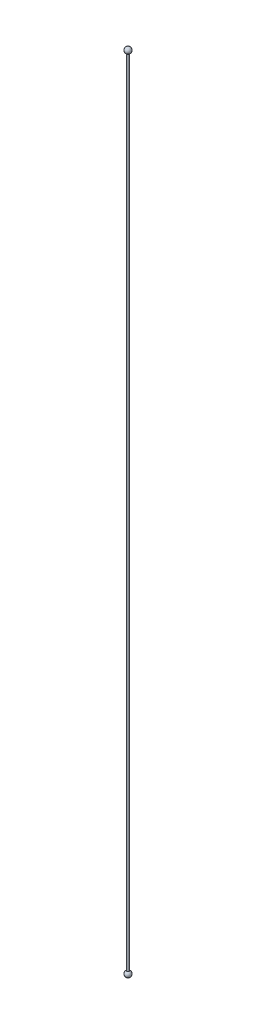
from build123d import *


with BuildPart() as part:
    # Sketch1 → Revolve1 (revolve)
    with BuildSketch(Plane.XY):
        with BuildLine():
            Line((0.4, -134.483484861), (0.4, 134.483484861))
            ThreePointArc((0.4, 134.483484861), (0.978906313, 135.604309644), (0, 136.4))
            Line((0, 136.4), (0, -136.4))
            ThreePointArc((0, -136.4), (0.978906313, -135.604309644), (0.4, -134.483484861))
        make_face()
    revolve(axis=Axis((0, 136.4, 0), (0, -1, 0)))


solid = part.part
